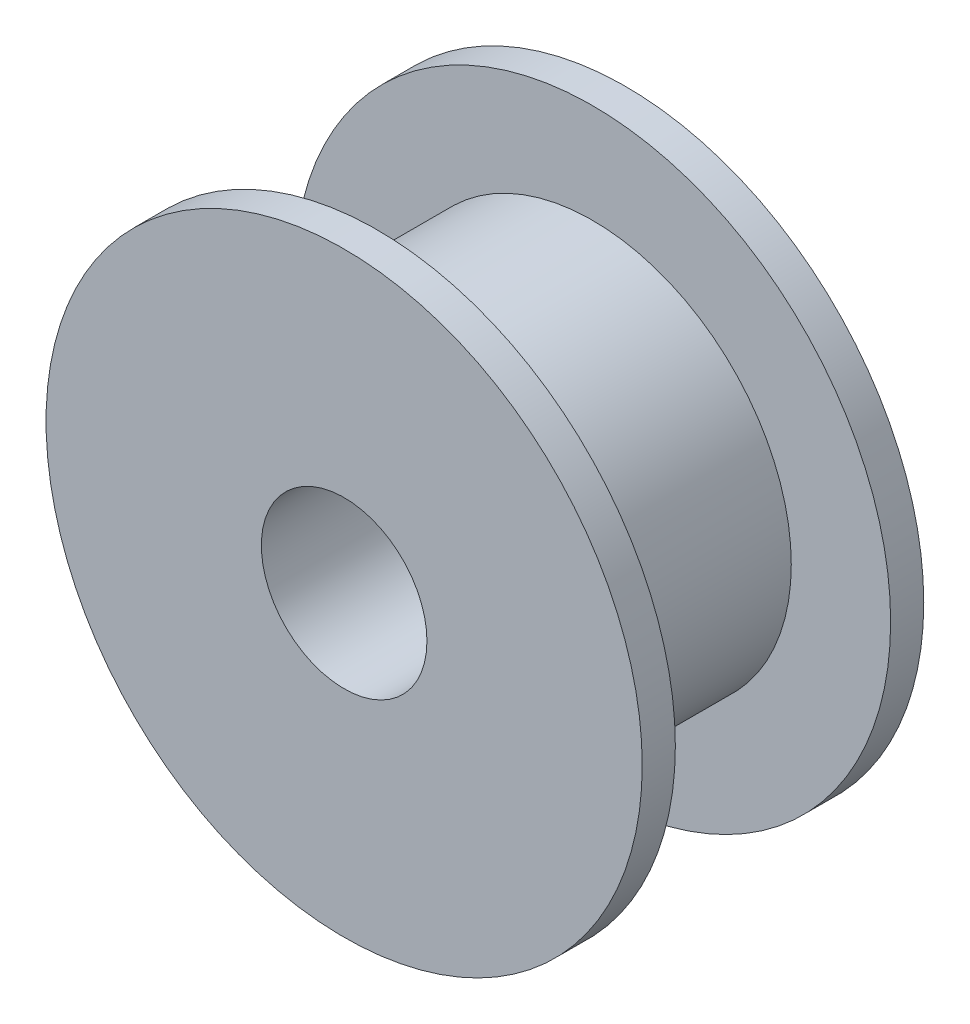
from build123d import *


with BuildPart() as part:
    # Sketch1 → Revolve1 (revolve)
    with BuildSketch(Plane(origin=(0, 0, 0), x_dir=(1, 0, 0), z_dir=(0, 1, 0))):
        Polygon((9, 0), (9, 1), (6, 1), (6, 7.5), (9, 7.5), (9, 8.5), (2.5, 8.5), (2.5, 0), align=None)
    revolve(axis=Axis((0, 0, 0), (0, 0, -1)))


solid = part.part
